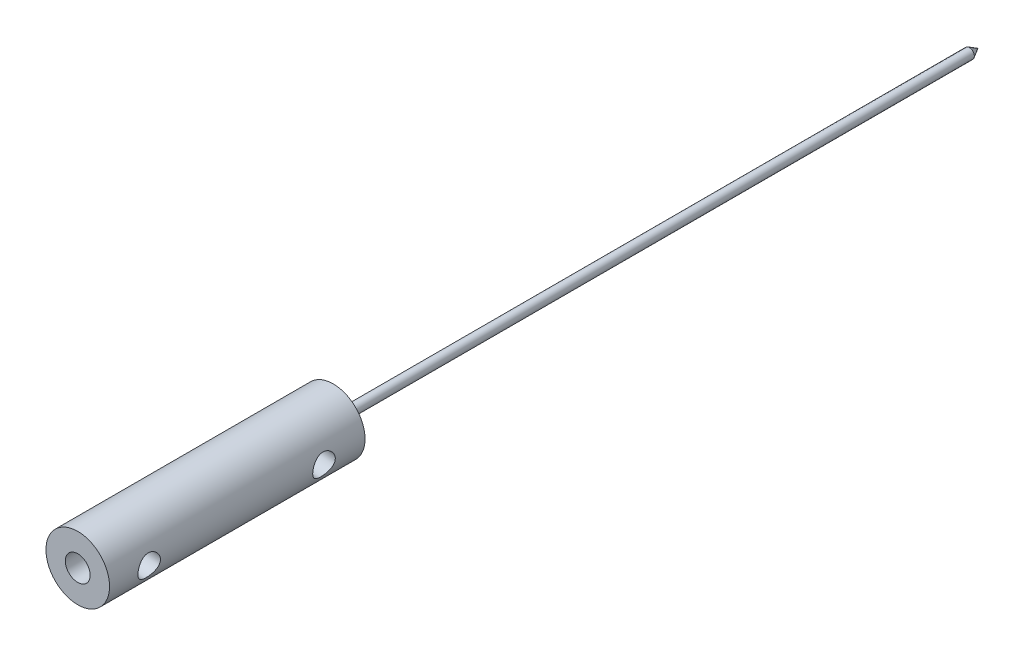
from build123d import *

# Parameters (mm, degrees)
SKETCH3_R                           = 3.2
SKETCH3_R_2                         = 0.5
BOSS_EXTRUDE2_DEPTH                 = 25.7
CUT_EXTRUDE1_DEPTH                  = 27.095401894
CUT_EXTRUDE1_DEPTH_BACK             = 25.7
SKETCH6_R                           = 1.25
TAP_DRILL_FOR_4_40_TAP1_D           = 2.2606
TAP_DRILL_FOR_4_40_TAP1_ON_FACE_2_D = 2.2606
BOSS_EXTRUDE4_START                 = 5
SKETCH3_4_R                         = 0.5
BOSS_EXTRUDE4_DEPTH                 = 69
BOSS_EXTRUDE5_START                 = -20.7
SKETCH6_2_R                         = 1.25
SKETCH6_2_R_2                       = 0.5
BOSS_EXTRUDE5_DEPTH                 = 5


with BuildPart() as part:
    # Sketch3 → Boss-Extrude2 (new body)
    with BuildSketch(Plane.XY):
        with Locations(Location((0, 0, 0), (0, 0, 180))):
            Circle(SKETCH3_R)
        Circle(SKETCH3_R_2, mode=Mode.SUBTRACT)
    extrude(amount=BOSS_EXTRUDE2_DEPTH)

    # Sketch6 → Cut-Extrude1 (cut, two sides: drawn at the far end of the back side and taken through both)
    with BuildSketch(Plane.XY.offset(25.7).offset(-CUT_EXTRUDE1_DEPTH_BACK)):
        with Locations(Location((0, 0, 0), (0, 0, 180))):
            Circle(SKETCH6_R)
    extrude(amount=CUT_EXTRUDE1_DEPTH + CUT_EXTRUDE1_DEPTH_BACK, mode=Mode.SUBTRACT)

    # Tap Drill for #4-40 Tap1 (through all)
    with Locations(Plane(origin=(3.187528357, -0.282246299, 21.7), x_dir=(0.088201968553, 0.996102611553, 0), z_dir=(0.996102611553, -0.088201968553, 0))):
        with Locations((0, 0)):
            Hole(TAP_DRILL_FOR_4_40_TAP1_D / 2)

    # Tap Drill for #4-40 Tap1 on face 2 (through all)
    with Locations(Plane(origin=(3.187528357, -0.282246299, 4.112360987), x_dir=(0.088201965627, 0.996102611812, 0), z_dir=(0.996102611812, -0.088201965627, 0))):
        with Locations((0, 0)):
            Hole(TAP_DRILL_FOR_4_40_TAP1_ON_FACE_2_D / 2)



with BuildPart() as body_2:
    # Sketch3<4> → Boss-Extrude4 (new body)
    with BuildSketch(Plane.XY.offset(BOSS_EXTRUDE4_START)):
        Circle(SKETCH3_4_R)
    extrude(amount=-BOSS_EXTRUDE4_DEPTH)

    # Sketch9 → Revolve1 (revolve)
    with BuildSketch(Plane(origin=(0, 0, 0), x_dir=(1, 0, 0), z_dir=(0, 1, 0)), mode=Mode.PRIVATE) as revolve1_sk:
        Polygon((0, 64), (-0.5, 64), (0, 64.866025404), align=None)
    revolve(revolve1_sk.sketch.rotate(Axis((0, 0, -64), (0, 0, -1)), 180), axis=Axis((0, 0, -64), (0, 0, -1)))


with BuildPart() as part_1:
    add(part.part)

    add(body_2.part)  # Boss-Extrude5 merges body 2
    # Sketch6<2> → Boss-Extrude5 (add)
    with BuildSketch(Plane.XY.offset(25.7).offset(BOSS_EXTRUDE5_START)):
        with Locations(Location((0, 0, 0), (0, 0, 208.982799993))):
            Circle(SKETCH6_2_R)
        Circle(SKETCH6_2_R_2, mode=Mode.SUBTRACT)
    extrude(amount=-BOSS_EXTRUDE5_DEPTH)


solid = part_1.part
